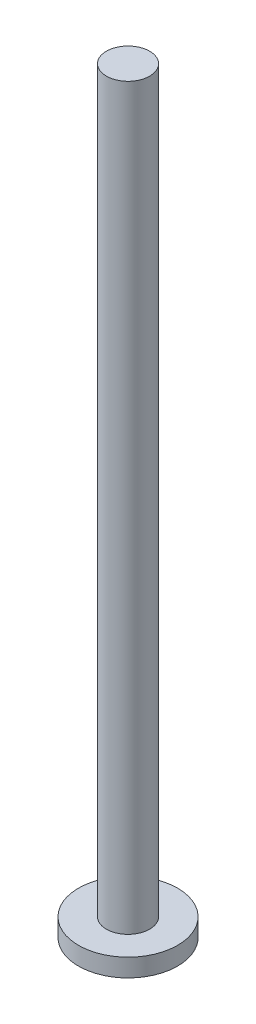
from build123d import *

# Parameters (mm, degrees)
SKETCH_1_R      = 2.4
EXTRUDE_1_DEPTH = 82
SKETCH_2_R      = 5.5
EXTRUDE_2_DEPTH = 2


with BuildPart() as part:
    # 草图1 → 凸台-拉伸1 (new body)
    with BuildSketch(Plane(origin=(0, 0, 0), x_dir=(1, 0, 0), z_dir=(0, 1, 0))):
        with Locations(Location((0, 0, 0), (0, 0, 270))):
            Circle(SKETCH_1_R)
    extrude(amount=EXTRUDE_1_DEPTH)

    # 草图2 → 凸台-拉伸2 (add)
    with BuildSketch(Plane.XZ):
        with Locations(Location((0, 0, 0), (0, 0, 270))):
            Circle(SKETCH_2_R)
    extrude(amount=EXTRUDE_2_DEPTH)


solid = part.part
